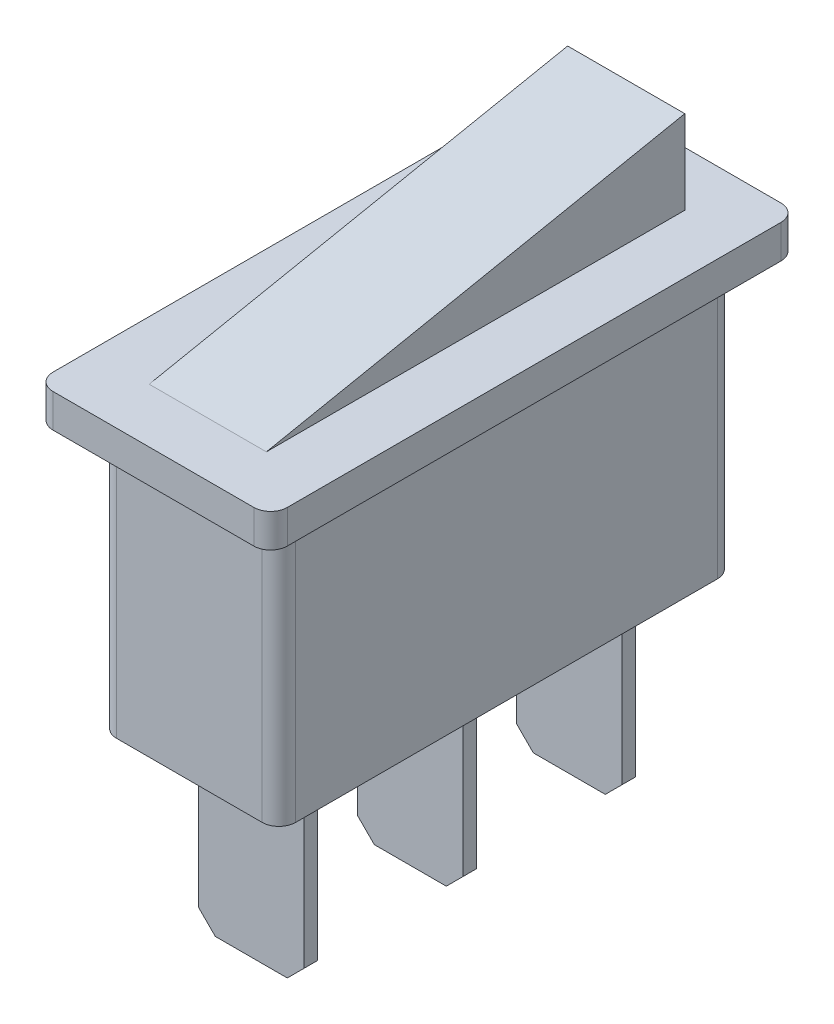
from build123d import *

# Parameters (mm, degrees)
SKIZZE1_W                            = 14
SKIZZE1_H                            = 31.5
AUFSATZ_LINEAR_AUSTRAGEN1_DEPTH      = 2
VERRUNDUNG1_R                        = 1
SKIZZE2_W                            = 10.7
SKIZZE2_H                            = 27.2
AUFSATZ_LINEAR_AUSTRAGEN2_DEPTH      = 16.2
VERRUNDUNG2_R                        = 1
SKIZZE3_W                            = 6.3
SKIZZE3_H                            = 0.8
AUFSATZ_LINEAR_AUSTRAGEN3_DEPTH      = 11
LINEARES_MUSTER1_COUNT               = 2
LINEARES_MUSTER1_PITCH               = 9.5
LINEARES_MUSTER1_COL_COUNT           = 2
LINEARES_MUSTER1_COL_PITCH           = 9.5
SCHNITT_LINEAR_AUSTRAGEN1_DEPTH      = 40.921955112
AUFSATZ_LINEAR_AUSTRAGEN4_DEPTH      = 3.5
AUFSATZ_LINEAR_AUSTRAGEN4_DEPTH_BACK = 3.5


with BuildPart() as part:
    # Skizze1 → Aufsatz-Linear austragen1 (new body)
    with BuildSketch(Plane(origin=(0, 0, 0), x_dir=(1, 0, 0), z_dir=(0, 1, 0))):
        with Locations((7, 15.75)):
            Rectangle(SKIZZE1_W, SKIZZE1_H)
    extrude(amount=AUFSATZ_LINEAR_AUSTRAGEN1_DEPTH)

    # Verrundung1
    verrundung1_edges = [part.edges().sort_by_distance(p)[0] for p in [
        (0, 1, -31.5),
        (14, 1, -31.5),
        (14, 1, 0),
        (0, 1, 0),
    ]]
    fillet(verrundung1_edges, radius=VERRUNDUNG1_R)

    # Skizze2 → Aufsatz-Linear austragen2 (add)
    with BuildSketch(Plane.XZ):
        with Locations((7, -15.75)):
            Rectangle(SKIZZE2_W, SKIZZE2_H)
    extrude(amount=AUFSATZ_LINEAR_AUSTRAGEN2_DEPTH)

    # Verrundung2
    verrundung2_edges = [part.edges().sort_by_distance(p)[0] for p in [
        (12.35, -8.1, -29.35),
        (12.35, -8.1, -2.15),
        (1.65, -8.1, -2.15),
        (1.65, -8.1, -29.35),
    ]]
    fillet(verrundung2_edges, radius=VERRUNDUNG2_R)

    # Skizze3 → Aufsatz-Linear austragen3 (add)
    with BuildSketch(Plane.XZ.offset(16.2)):
        with Locations((7, -15.75)):
            Rectangle(SKIZZE3_W, SKIZZE3_H)
    aufsatz_linear_austragen3 = extrude(amount=AUFSATZ_LINEAR_AUSTRAGEN3_DEPTH)

    # Lineares Muster1: Aufsatz-Linear austragen3 ×2
    with Locations(*[(0, 0, -i * LINEARES_MUSTER1_PITCH) for i in range(1, LINEARES_MUSTER1_COUNT)]):
        add(aufsatz_linear_austragen3)

    # Lineares Muster1 col: Aufsatz-Linear austragen3 ×2
    with Locations(*[(0, 0, i * LINEARES_MUSTER1_COL_PITCH) for i in range(1, LINEARES_MUSTER1_COL_COUNT)]):
        add(aufsatz_linear_austragen3)

    # Skizze4 → Schnitt-Linear austragen1 (cut, through all)
    with BuildSketch(Plane.XY.offset(-5.85)):
        Polygon((3.85, -26.2), (3.85, -27.2), (4.85, -27.2), align=None)
        Polygon((9.15, -27.2), (10.15, -26.2), (10.15, -27.2), align=None)
    extrude(amount=-SCHNITT_LINEAR_AUSTRAGEN1_DEPTH, mode=Mode.SUBTRACT)

    # Skizze5 → Aufsatz-Linear austragen4 (add, two sides: drawn at the far end of the back side and taken through both)
    with BuildSketch(Plane(origin=(7, 0, 0), x_dir=(0, 0, -1), z_dir=(1, 0, 0)).offset(-AUFSATZ_LINEAR_AUSTRAGEN4_DEPTH_BACK)):
        Polygon((3.25, 2), (28.25, 7), (28.25, 2), align=None)
    extrude(amount=AUFSATZ_LINEAR_AUSTRAGEN4_DEPTH + AUFSATZ_LINEAR_AUSTRAGEN4_DEPTH_BACK)


solid = part.part
